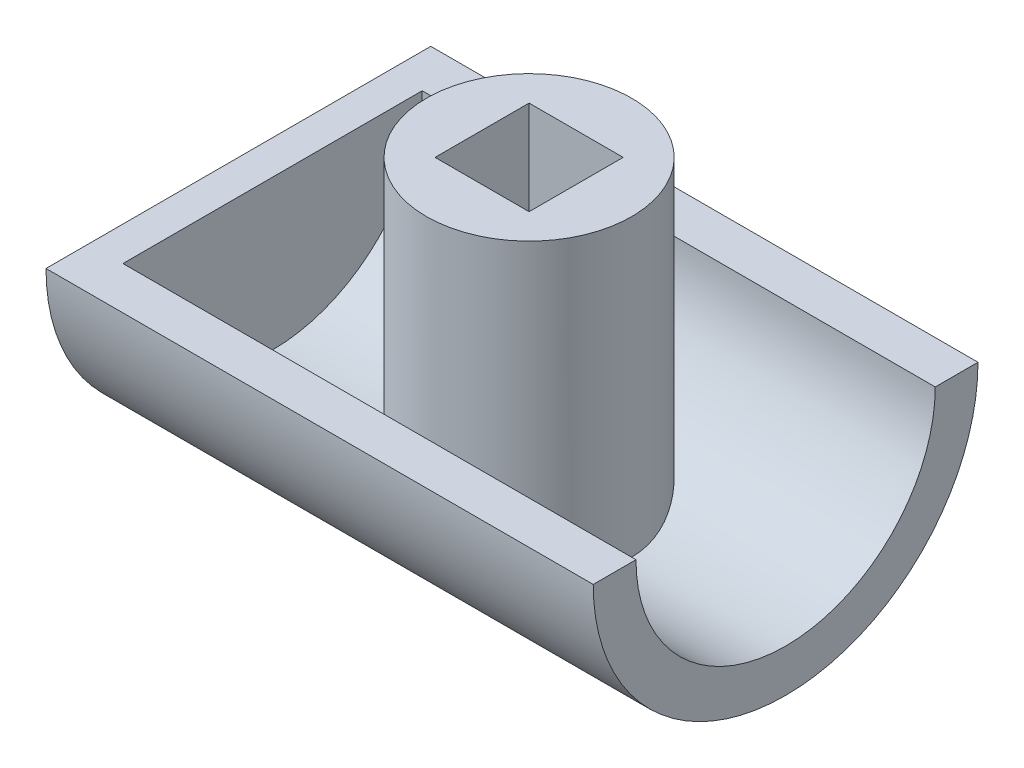
from build123d import *

# Parameters (mm, degrees)
BOSS_EXTRUDE1_DEPTH             = 30
BOSS_EXTRUDE1_DEPTH_BACK        = 30
BOSS_EXTRUDE2_REACH             = 45.732
BOSS_EXTRUDE2_END_RADIUS        = 17.5
SKETCH3_R                       = 12
BOSS_EXTRUDE2_DIRECTION_2_DEPTH = 17
BOSS_EXTRUDE3_START             = 4
BOSS_EXTRUDE3_DEPTH             = 4
SKETCH5_W                       = 11
SKETCH5_H                       = 11
CUT_EXTRUDE1_DEPTH              = 17


with BuildPart() as part:
    # Sketch1 → Boss-Extrude1 (new, two sides: drawn at the far end of the back side and taken through both)
    with BuildSketch(Plane(origin=(0, 0, 0), x_dir=(0, 0, -1), z_dir=(1, 0, 0)).offset(-BOSS_EXTRUDE1_DEPTH_BACK)):
        with BuildLine():
            Line((-17.5, 0), (-22.5, 0))
            ThreePointArc((-22.5, 0), (0, -22.5), (22.5, 0))
            Line((22.5, 0), (17.5, 0))
            ThreePointArc((17.5, 0), (0, -17.5), (-17.5, 0))
        make_face()
    extrude(amount=BOSS_EXTRUDE1_DEPTH + BOSS_EXTRUDE1_DEPTH_BACK)

    # Boss-Extrude2: up to this cylinder (the profile starts inside it)
    boss_extrude2_end = Plane(origin=(0, 0, 0), z_dir=(1, 0, 0)) * Cylinder(BOSS_EXTRUDE2_END_RADIUS, 127.464, mode=Mode.PRIVATE)
    # Sketch3 → Boss-Extrude2 (add, up to the surface)
    with BuildSketch(Plane(origin=(0, 0, 0), x_dir=(1, 0, 0), z_dir=(0, 1, 0)), mode=Mode.PRIVATE) as boss_extrude2_sk1:
        Circle(SKETCH3_R)
    boss_extrude2_tool1 = extrude(boss_extrude2_sk1.sketch, amount=-BOSS_EXTRUDE2_REACH, mode=Mode.PRIVATE) & boss_extrude2_end
    add(boss_extrude2_tool1.solids().sort_by_distance((0, 0, 0))[0])

    # Sketch3 → Boss-Extrude2 direction 2 (add)
    with BuildSketch(Plane(origin=(0, 0, 0), x_dir=(1, 0, 0), z_dir=(0, 1, 0))):
        Circle(SKETCH3_R)
    extrude(amount=BOSS_EXTRUDE2_DIRECTION_2_DEPTH)

    # Sketch4 → Boss-Extrude3 (add)
    with BuildSketch(Plane.ZY.offset(30).offset(BOSS_EXTRUDE3_START)):
        with BuildLine():
            Line((-22.5, 0), (22.5, 0))
            ThreePointArc((22.5, 0), (0, -22.5), (-22.5, 0))
        make_face()
    extrude(amount=-BOSS_EXTRUDE3_DEPTH)

    # Sketch5 → Cut-Extrude1 (cut)
    with BuildSketch(Plane(origin=(0, 17, 0), x_dir=(1, 0, 0), z_dir=(0, 1, 0))):
        Rectangle(SKETCH5_W, SKETCH5_H)
    extrude(amount=-CUT_EXTRUDE1_DEPTH, mode=Mode.SUBTRACT)


solid = part.part
